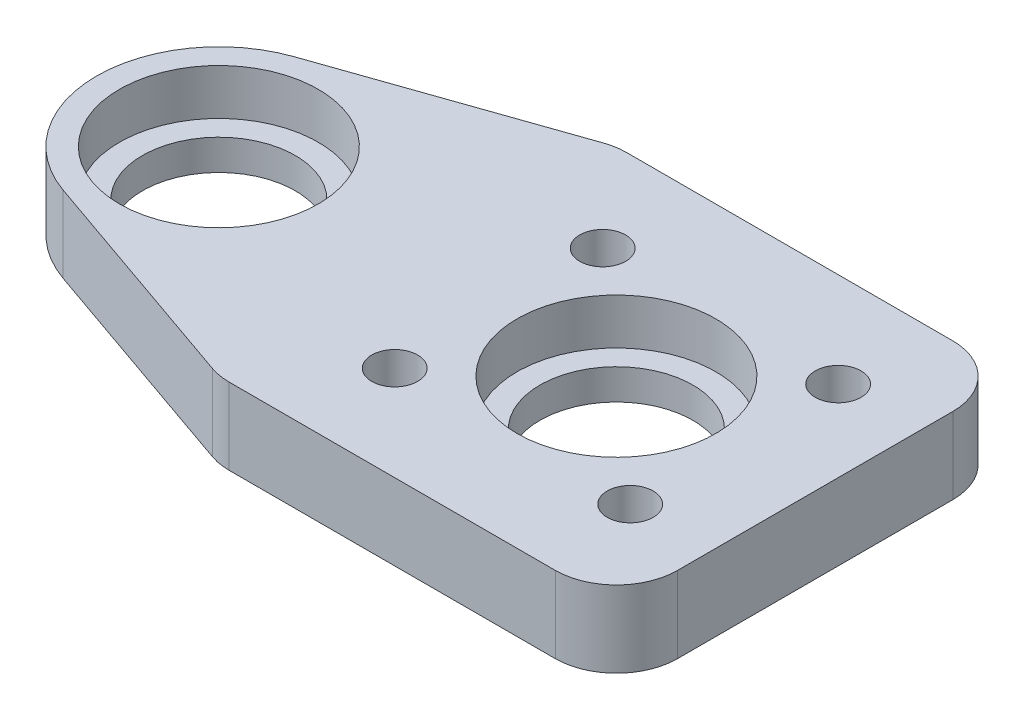
from build123d import *

# Parameters (mm, degrees)
SKETCH_1_R          = 1.5
SKETCH_1_R_2        = 5
EXTRUDE_1_DEPTH     = 5
SKETCH_2_R          = 6.5
CUT_EXTRUDE_1_DEPTH = 3
FILLET_1_R          = 4


with BuildPart() as part:
    # Эскиз1 → Бобышка-Вытянуть1 (new body)
    with BuildSketch(Plane(origin=(0, -185.809804521, 0), x_dir=(1, 0, 0), z_dir=(0, 1, 0))):
        with BuildLine():
            Line((-450.111062941, 89.302859511), (-450.111062941, 76.302859511))
            Line((-450.111062941, 76.302859511), (-476.111062941, 76.302859511))
            Line((-476.111062941, 76.302859511), (-491.742757589, 81.748272926))
            ThreePointArc((-491.742757589, 81.748272926), (-497.110912638, 89.302859511), (-491.742757589, 96.857446095))
            Line((-491.742757589, 96.857446095), (-476.111062941, 102.302859511))
            Line((-476.111062941, 102.302859511), (-450.111062941, 102.302859511))
            Line((-450.111062941, 102.302859511), (-450.111062941, 89.302859511))
        make_face()
        with Locations(Location((-470.811062941, 96.102859511, 0), (0, 0, 270))):
            Circle(SKETCH_1_R, mode=Mode.SUBTRACT)
        with Locations(Location((-455.411062941, 96.102859511, 0), (0, 0, 270))):
            Circle(SKETCH_1_R, mode=Mode.SUBTRACT)
        with Locations(Location((-455.411062941, 82.502859511, 0), (0, 0, 270))):
            Circle(SKETCH_1_R, mode=Mode.SUBTRACT)
        with Locations(Location((-470.811062941, 82.502859511, 0), (0, 0, 270))):
            Circle(SKETCH_1_R, mode=Mode.SUBTRACT)
        with Locations(Location((-463.111062941, 89.302859511, 0), (0, 0, 270))):
            Circle(SKETCH_1_R_2, mode=Mode.SUBTRACT)
        with Locations(Location((-489.111062941, 89.302859511, 0), (0, 0, 270))):
            Circle(SKETCH_1_R_2, mode=Mode.SUBTRACT)
    extrude(amount=EXTRUDE_1_DEPTH)

    # Эскиз2 → Вырез-Вытянуть1 (cut)
    with BuildSketch(Plane(origin=(0, -180.809804521, 0), x_dir=(1, 0, 0), z_dir=(0, 1, 0))):
        with Locations(Location((-463.111062941, 89.302859511, 0), (0, 0, 270))):
            Circle(SKETCH_2_R)
        with Locations(Location((-489.111062941, 89.302859511, 0), (0, 0, 270))):
            Circle(SKETCH_2_R)
    extrude(amount=-CUT_EXTRUDE_1_DEPTH, mode=Mode.SUBTRACT)

    # Скругление1
    fillet_1_edges = [part.edges().sort_by_distance(p)[0] for p in [
        (-476.111062941, -183.309804521, -102.302859511),
        (-450.111062941, -183.309804521, -102.302859511),
        (-450.111062941, -183.309804521, -76.302859511),
        (-476.111062941, -183.309804521, -76.302859511),
    ]]
    fillet(fillet_1_edges, radius=FILLET_1_R)


solid = part.part
